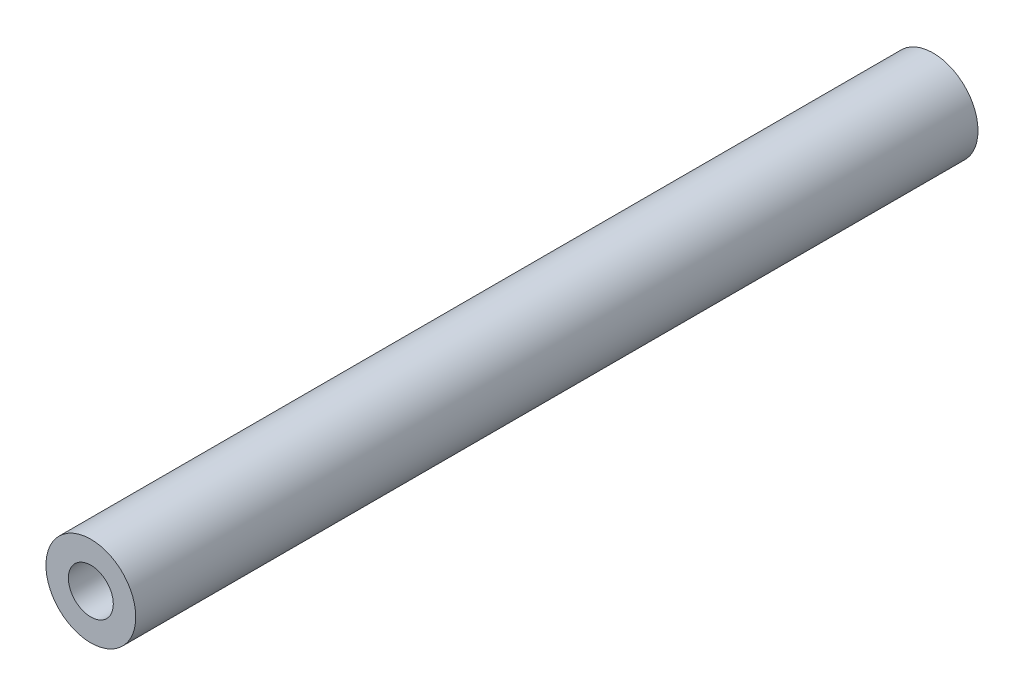
from build123d import *

# Parameters (mm, degrees)
SKETCH1_R           = 4
BOSS_EXTRUDE1_DEPTH = 37.5
SKETCH2_R           = 2
CUT_EXTRUDE1_DEPTH  = 4


with BuildPart() as part:
    # Sketch1 → Boss-Extrude1 (new, symmetric)
    with BuildSketch(Plane.XY):
        Circle(SKETCH1_R)
    extrude(amount=BOSS_EXTRUDE1_DEPTH, both=True)

    # Sketch2 → Cut-Extrude1 (cut)
    with BuildSketch(Plane.XY.offset(37.5)):
        Circle(SKETCH2_R)
    cut_extrude1 = extrude(amount=-CUT_EXTRUDE1_DEPTH, mode=Mode.SUBTRACT)

    # Mirror1: Cut-Extrude1 across plane
    add(cut_extrude1.mirror(Plane.XY), mode=Mode.SUBTRACT)


solid = part.part
